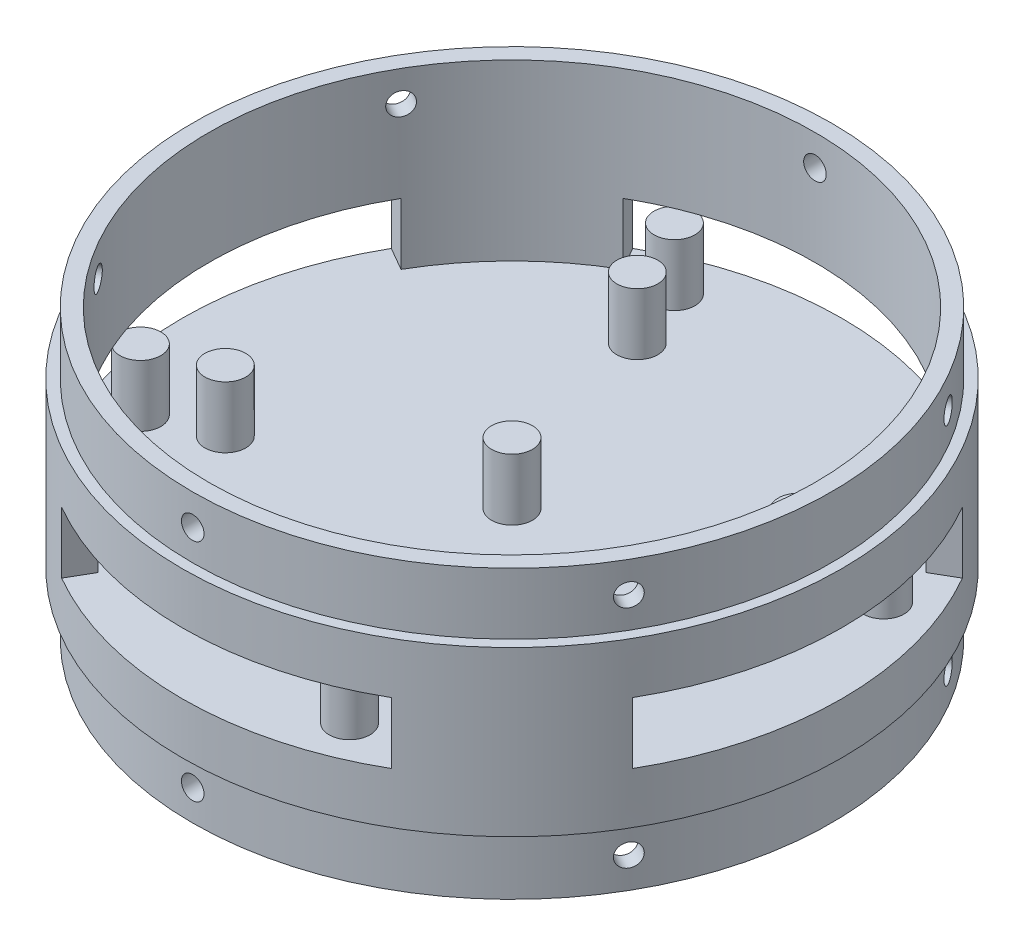
from build123d import *

# Parameters (mm, degrees)
SKETCH1_R               = 51.1048
SKETCH1_R_2             = 46.99
BOSS_EXTRUDE1_DEPTH     = 25.4
BOSS_EXTRUDE2_START     = 25.4
SKETCH1_3_R             = 49.5173
SKETCH1_3_R_2           = 46.99
BOSS_EXTRUDE2_DEPTH     = 9.525
BOSS_EXTRUDE3_START     = -9.525
SKETCH1_4_R             = 49.5173
SKETCH1_4_R_2           = 46.99
BOSS_EXTRUDE3_DEPTH     = 9.525
CUT_EXTRUDE2_REACH      = 120.137
CUT_EXTRUDE2_END_RADIUS = 46.99
CUT_EXTRUDE3_START      = 12.7
CUT_EXTRUDE3_DEPTH      = 4.7625
CIRPATTERN2_COUNT       = 4
CIRPATTERN3_COUNT       = 6
BOSS_EXTRUDE4_START     = -6.35
SKETCH4_R               = 46.99
BOSS_EXTRUDE4_DEPTH     = 6.35
SKETCH5_R               = 3.175
BOSS_EXTRUDE5_DEPTH     = 9.525
CIRPATTERN4_COUNT       = 4


with BuildPart() as part:
    # Sketch1 → Boss-Extrude1 (new body)
    with BuildSketch(Plane(origin=(0, 0, 0), x_dir=(1, 0, 0), z_dir=(0, 1, 0))):
        with Locations(Location((0, 0, 0), (0, 0, 270))):
            Circle(SKETCH1_R)
        with Locations(Location((0, 0, 0), (0, 0, 270))):
            Circle(SKETCH1_R_2, mode=Mode.SUBTRACT)
    extrude(amount=BOSS_EXTRUDE1_DEPTH)

    # Sketch1<3> → Boss-Extrude2 (add)
    with BuildSketch(Plane(origin=(0, 0, 0), x_dir=(1, 0, 0), z_dir=(0, 1, 0)).offset(BOSS_EXTRUDE2_START)):
        with Locations(Location((0, 0, 0), (0, 0, 90))):
            Circle(SKETCH1_3_R)
        with Locations(Location((0, 0, 0), (0, 0, 270))):
            Circle(SKETCH1_3_R_2, mode=Mode.SUBTRACT)
    extrude(amount=BOSS_EXTRUDE2_DEPTH)

    # Sketch1<4> → Boss-Extrude3 (add)
    with BuildSketch(Plane(origin=(0, 0, 0), x_dir=(1, 0, 0), z_dir=(0, 1, 0)).offset(BOSS_EXTRUDE3_START)):
        with Locations(Location((0, 0, 0), (0, 0, 90))):
            Circle(SKETCH1_4_R)
        with Locations(Location((0, 0, 0), (0, 0, 270))):
            Circle(SKETCH1_4_R_2, mode=Mode.SUBTRACT)
    extrude(amount=BOSS_EXTRUDE3_DEPTH)

    # Cut-Extrude2: up to this cylinder (the profile starts outside it)
    cut_extrude2_end = Plane(origin=(0, 12.7, 0), z_dir=(0, -1, 0)) * Cylinder(CUT_EXTRUDE2_END_RADIUS, 370.179, mode=Mode.PRIVATE)
    # Sketch3 → Cut-Extrude2 (cut, up to the surface)
    with BuildSketch(Plane(origin=(0, 0, -49.5173), x_dir=(-1, 0, 0), z_dir=(0, 0, -1)), mode=Mode.PRIVATE) as cut_extrude2_sk1:
        with BuildLine():
            ThreePointArc((1.75, 30.1625), (1.237436867, 31.399936867), (0, 31.9125))
            Line((0, 31.9125), (0, 28.4125))
            ThreePointArc((0, 28.4125), (1.237436867, 28.925063133), (1.75, 30.1625))
        make_face()
    cut_extrude2_tool1 = extrude(cut_extrude2_sk1.sketch, amount=-CUT_EXTRUDE2_REACH, mode=Mode.PRIVATE) - cut_extrude2_end
    # Sketch3 → Cut-Extrude2 (cut, up to the surface)
    with BuildSketch(Plane(origin=(0, 0, -49.5173), x_dir=(-1, 0, 0), z_dir=(0, 0, -1)), mode=Mode.PRIVATE) as cut_extrude2_sk2:
        with BuildLine():
            Line((0, 28.4125), (0, 31.9125))
            ThreePointArc((0, 31.9125), (-1.75, 30.1625), (0, 28.4125))
        make_face()
    cut_extrude2_tool2 = extrude(cut_extrude2_sk2.sketch, amount=-CUT_EXTRUDE2_REACH, mode=Mode.PRIVATE) - cut_extrude2_end
    # Sketch3 → Cut-Extrude2 (cut, up to the surface)
    with BuildSketch(Plane(origin=(0, 0, -49.5173), x_dir=(-1, 0, 0), z_dir=(0, 0, -1)), mode=Mode.PRIVATE) as cut_extrude2_sk3:
        with BuildLine():
            ThreePointArc((1.75, 30.1625), (1.237436867, 31.399936867), (0, 31.9125))
            Line((0, 31.9125), (0, 28.4125))
            ThreePointArc((0, 28.4125), (1.237436867, 28.925063133), (1.75, 30.1625))
        make_face()
    cut_extrude2_tool3 = extrude(cut_extrude2_sk3.sketch, amount=-CUT_EXTRUDE2_REACH, mode=Mode.PRIVATE) - cut_extrude2_end
    # Sketch3 → Cut-Extrude2 (cut, up to the surface)
    with BuildSketch(Plane(origin=(0, 0, -49.5173), x_dir=(-1, 0, 0), z_dir=(0, 0, -1)), mode=Mode.PRIVATE) as cut_extrude2_sk4:
        with BuildLine():
            Line((0, 28.4125), (0, 31.9125))
            ThreePointArc((0, 31.9125), (-1.75, 30.1625), (0, 28.4125))
        make_face()
    cut_extrude2_tool4 = extrude(cut_extrude2_sk4.sketch, amount=-CUT_EXTRUDE2_REACH, mode=Mode.PRIVATE) - cut_extrude2_end
    # Sketch3 → Cut-Extrude2 (cut, up to the surface)
    with BuildSketch(Plane(origin=(0, 0, -49.5173), x_dir=(-1, 0, 0), z_dir=(0, 0, -1)), mode=Mode.PRIVATE) as cut_extrude2_sk5:
        with BuildLine():
            ThreePointArc((1.75, -4.7625), (1.237436867, -3.525063133), (0, -3.0125))
            Line((0, -3.0125), (0, -6.5125))
            ThreePointArc((0, -6.5125), (1.237436867, -5.999936867), (1.75, -4.7625))
        make_face()
    cut_extrude2_tool5 = extrude(cut_extrude2_sk5.sketch, amount=-CUT_EXTRUDE2_REACH, mode=Mode.PRIVATE) - cut_extrude2_end
    # Sketch3 → Cut-Extrude2 (cut, up to the surface)
    with BuildSketch(Plane(origin=(0, 0, -49.5173), x_dir=(-1, 0, 0), z_dir=(0, 0, -1)), mode=Mode.PRIVATE) as cut_extrude2_sk6:
        with BuildLine():
            Line((0, -6.5125), (0, -3.0125))
            ThreePointArc((0, -3.0125), (-1.75, -4.7625), (0, -6.5125))
        make_face()
    cut_extrude2_tool6 = extrude(cut_extrude2_sk6.sketch, amount=-CUT_EXTRUDE2_REACH, mode=Mode.PRIVATE) - cut_extrude2_end
    # Sketch3 → Cut-Extrude2 (cut, up to the surface)
    with BuildSketch(Plane(origin=(0, 0, -49.5173), x_dir=(-1, 0, 0), z_dir=(0, 0, -1)), mode=Mode.PRIVATE) as cut_extrude2_sk7:
        with BuildLine():
            ThreePointArc((1.75, -4.7625), (1.237436867, -3.525063133), (0, -3.0125))
            Line((0, -3.0125), (0, -6.5125))
            ThreePointArc((0, -6.5125), (1.237436867, -5.999936867), (1.75, -4.7625))
        make_face()
    cut_extrude2_tool7 = extrude(cut_extrude2_sk7.sketch, amount=-CUT_EXTRUDE2_REACH, mode=Mode.PRIVATE) - cut_extrude2_end
    # Sketch3 → Cut-Extrude2 (cut, up to the surface)
    with BuildSketch(Plane(origin=(0, 0, -49.5173), x_dir=(-1, 0, 0), z_dir=(0, 0, -1)), mode=Mode.PRIVATE) as cut_extrude2_sk8:
        with BuildLine():
            Line((0, -6.5125), (0, -3.0125))
            ThreePointArc((0, -3.0125), (-1.75, -4.7625), (0, -6.5125))
        make_face()
    cut_extrude2_tool8 = extrude(cut_extrude2_sk8.sketch, amount=-CUT_EXTRUDE2_REACH, mode=Mode.PRIVATE) - cut_extrude2_end
    cut_extrude2 = cut_extrude2_tool1.solids().sort_by_distance((-0.742723, 30.1625, -49.5173))[0] + cut_extrude2_tool2.solids().sort_by_distance((0.742723, 30.1625, -49.5173))[0] + cut_extrude2_tool3.solids().sort_by_distance((-0.742723, 30.1625, -49.5173))[0] + cut_extrude2_tool4.solids().sort_by_distance((0.742723, 30.1625, -49.5173))[0] + cut_extrude2_tool5.solids().sort_by_distance((-0.742723, -4.7625, -49.5173))[0] + cut_extrude2_tool6.solids().sort_by_distance((0.742723, -4.7625, -49.5173))[0] + cut_extrude2_tool7.solids().sort_by_distance((-0.742723, -4.7625, -49.5173))[0] + cut_extrude2_tool8.solids().sort_by_distance((0.742723, -4.7625, -49.5173))[0]
    add(cut_extrude2, mode=Mode.SUBTRACT)

    # Sketch1<7> → Cut-Extrude3 (cut, symmetric)
    with BuildSketch(Plane(origin=(0, 0, 0), x_dir=(1, 0, 0), z_dir=(0, 1, 0)).offset(CUT_EXTRUDE3_START)):
        with BuildLine():
            ThreePointArc((0, 46.99), (12.161906929, 45.388854577), (23.495, 40.694533724))
            Line((23.495, 40.694533724), (24.75865, 42.883239727))
            ThreePointArc((24.75865, 42.883239727), (12.816020302, 47.830038918), (0, 49.5173))
            Line((0, 49.5173), (0, 46.99))
        make_face()
        with BuildLine():
            Line((-24.75865, 42.883239727), (-23.495, 40.694533724))
            ThreePointArc((-23.495, 40.694533724), (-12.161906929, 45.388854577), (0, 46.99))
            Line((0, 46.99), (0, 49.5173))
            ThreePointArc((0, 49.5173), (-12.816020302, 47.830038918), (-24.75865, 42.883239727))
        make_face()
        with BuildLine():
            Line((-25.5524, 44.258055055), (-24.75865, 42.883239727))
            ThreePointArc((-24.75865, 42.883239727), (-12.816020302, 47.830038918), (0, 49.5173))
            Line((0, 49.5173), (0, 51.1048))
            ThreePointArc((0, 51.1048), (-13.226895536, 49.363446167), (-25.5524, 44.258055055))
        make_face()
        with BuildLine():
            ThreePointArc((0, 49.5173), (12.816020302, 47.830038918), (24.75865, 42.883239727))
            Line((24.75865, 42.883239727), (25.5524, 44.258055055))
            ThreePointArc((25.5524, 44.258055055), (13.226895536, 49.363446167), (0, 51.1048))
            Line((0, 51.1048), (0, 49.5173))
        make_face()
    cut_extrude3 = extrude(amount=CUT_EXTRUDE3_DEPTH, both=True, mode=Mode.SUBTRACT)

    # CirPattern2: Cut-Extrude3 ×4 about axis
    cirpattern2_axis = Axis((0, 0, 0), (0, 1, 0))
    for i in range(1, CIRPATTERN2_COUNT):
        add(cut_extrude3.rotate(cirpattern2_axis, i * 360 / CIRPATTERN2_COUNT), mode=Mode.SUBTRACT)

    # CirPattern3: Cut-Extrude2 ×6 about axis
    cirpattern3_axis = Axis((0, 0, 0), (0, 1, 0))
    for i in range(1, CIRPATTERN3_COUNT):
        add(cut_extrude2.rotate(cirpattern3_axis, i * 360 / CIRPATTERN3_COUNT), mode=Mode.SUBTRACT)

    # Sketch4 → Boss-Extrude4 (add)
    with BuildSketch(Plane(origin=(0, 7.9375, 0), x_dir=(1, 0, 0), z_dir=(0, 1, 0)).offset(BOSS_EXTRUDE4_START)):
        with Locations(Location((0, 0, 0), (0, 0, 180))):
            Circle(SKETCH4_R)
    extrude(amount=BOSS_EXTRUDE4_DEPTH)

    # Sketch5 → Boss-Extrude5 (add)
    with BuildSketch(Plane(origin=(0, 7.9375, 0), x_dir=(1, 0, 0), z_dir=(0, 1, 0))):
        with Locations(Location((-16.21128288, 41.388365604, 0), (0, 0, 73.308933621))):
            Circle(SKETCH5_R)
        with Locations(Location((0, 0, 0), (0, 0, 90))):
            Circle(SKETCH5_R)
        with Locations(Location((-12.505846793, 31.928167752, 0), (0, 0, 90))):
            Circle(SKETCH5_R)
    boss_extrude5 = extrude(amount=BOSS_EXTRUDE5_DEPTH)

    # CirPattern4: Boss-Extrude5 ×4 about axis
    cirpattern4_axis = Axis((0, 0, 0), (0, 1, 0))
    for i in range(1, CIRPATTERN4_COUNT):
        add(boss_extrude5.rotate(cirpattern4_axis, i * 360 / CIRPATTERN4_COUNT))


solid = part.part
